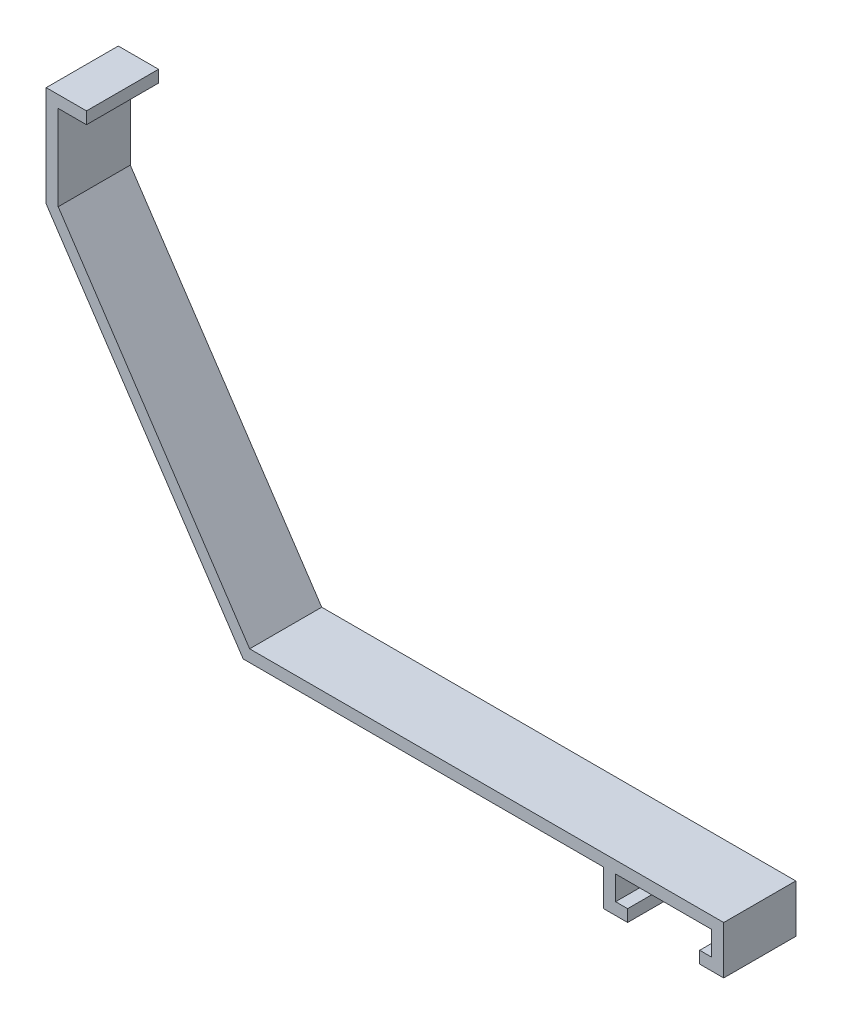
from build123d import *

# Parameters (mm, degrees)
BOSS_EXTRUDE1_DEPTH = 9.525


with BuildPart() as part:
    # Sketch1 → Boss-Extrude1 (new body)
    with BuildSketch(Plane.XY):
        Polygon((0, 0), (-5.3213, 0), (-5.3213, -13.319159726), (20.715282574, -52.374133315), (68.340282574, -52.374133315), (68.340282574, -57.136633315), (71.515282574, -57.136633315), (71.515282574, -55.549133315), (69.927782574, -55.549133315), (69.927782574, -52.374133315), (82.627782574, -52.374133315), (82.627782574, -55.549133315), (81.040282574, -55.549133315), (81.040282574, -57.136633315), (84.215282574, -57.136633315), (84.215282574, -50.786633315), (21.564887994, -50.786633315), (-3.7338, -12.838504422), (-3.7338, -1.5875), (0, -1.5875), align=None)
    extrude(amount=BOSS_EXTRUDE1_DEPTH)


solid = part.part
